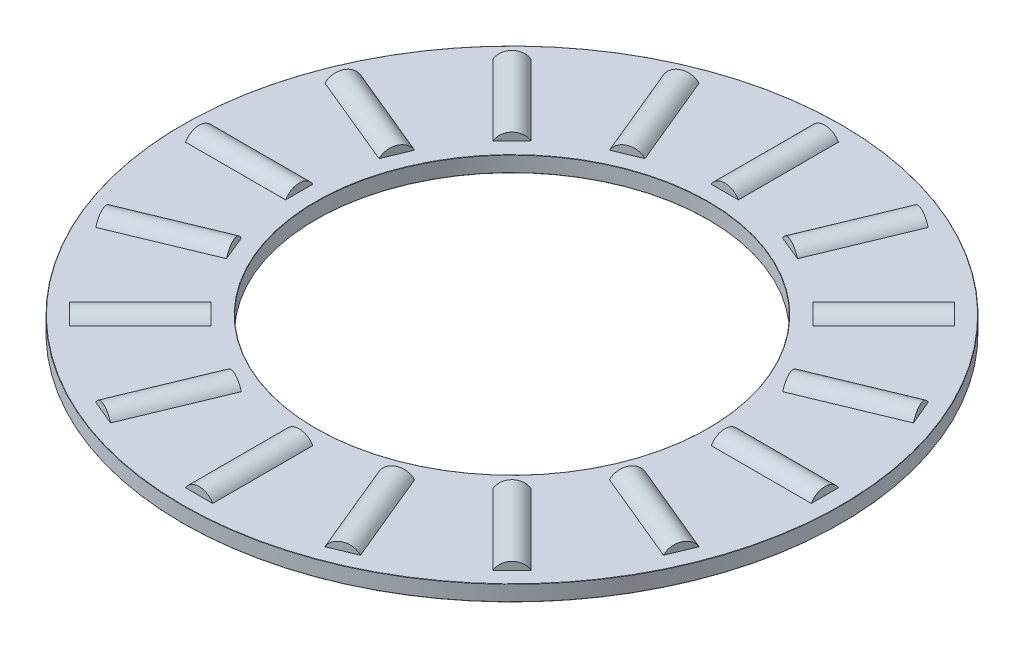
from build123d import *

# Parameters (mm, degrees)
SKETCH1_W         = 8.5
SKETCH1_H         = 1
SKETCH3_W         = 6.375
SKETCH3_H         = 1
SKETCH2_W         = 6.375
SKETCH2_H         = 1
CIRPATTERN1_COUNT = 16
CIRPATTERN1_ANGLE = 337.5
CIRPATTERN2_COUNT = 16
FILLET2_R         = 0.02


with BuildPart() as part:
    # Sketch1 → Revolve1 (revolve)
    with BuildSketch(Plane(origin=(0, 0, 0), x_dir=(0, 0, -1), z_dir=(1, 0, 0)), mode=Mode.PRIVATE) as revolve1_sk:
        with Locations((-16.75, 0)):
            Rectangle(SKETCH1_W, SKETCH1_H)
    revolve(revolve1_sk.sketch.rotate(Axis((0, -1, 0), (0, 1, 0)), 180), axis=Axis((0, -1, 0), (0, 1, 0)))

    # Sketch3 → Cut-Revolve1 (revolve, cut)
    with BuildSketch(Plane(origin=(0, 0, 0), x_dir=(0, 0, -1), z_dir=(1, 0, 0))):
        with Locations((-16.75, 0.5)):
            Rectangle(SKETCH3_W, SKETCH3_H)
    cut_revolve1 = revolve(axis=Axis((0, 0, 19.9375), (0, 0, -1)), mode=Mode.SUBTRACT)

    # CirPattern2: Cut-Revolve1 ×16 about axis
    cirpattern2_axis = Axis((0, 0, 0), (0, 1, 0))
    for i in range(1, CIRPATTERN2_COUNT):
        add(cut_revolve1.rotate(cirpattern2_axis, i * 360 / CIRPATTERN2_COUNT), mode=Mode.SUBTRACT)

    # Fillet2
    fillet2_edges = [part.edges().sort_by_distance(p)[0] for p in [
        (0, 0.5, 21),
        (0, 0.5, 12.5),
        (0, -0.5, 12.5),
        (0, -0.5, 21),
    ]]
    fillet(fillet2_edges, radius=FILLET2_R)


with BuildPart() as body_2:
    # Sketch2 → Revolve2 (revolve)
    with BuildSketch(Plane(origin=(0, 0, 0), x_dir=(0, 0, -1), z_dir=(1, 0, 0)), mode=Mode.PRIVATE) as revolve2_sk:
        with Locations((-16.75, 0.5)):
            Rectangle(SKETCH2_W, SKETCH2_H)
    revolve(revolve2_sk.sketch.rotate(Axis((0, 0, 19.9375), (0, 0, -1)), 90), axis=Axis((0, 0, 19.9375), (0, 0, -1)))


with BuildPart() as cirpattern1_1:
    # CirPattern1: pattern copy
    add(body_2.part.rotate(Axis((0, 1, 0), (0, -1, 0)), 1 * CIRPATTERN1_ANGLE / (CIRPATTERN1_COUNT - 1)))


with BuildPart() as cirpattern1_2:
    # CirPattern1: pattern copy
    add(body_2.part.rotate(Axis((0, 1, 0), (0, -1, 0)), 2 * CIRPATTERN1_ANGLE / (CIRPATTERN1_COUNT - 1)))


with BuildPart() as cirpattern1_3:
    # CirPattern1: pattern copy
    add(body_2.part.rotate(Axis((0, 1, 0), (0, -1, 0)), 3 * CIRPATTERN1_ANGLE / (CIRPATTERN1_COUNT - 1)))


with BuildPart() as cirpattern1_4:
    # CirPattern1: pattern copy
    add(body_2.part.rotate(Axis((0, 1, 0), (0, -1, 0)), 4 * CIRPATTERN1_ANGLE / (CIRPATTERN1_COUNT - 1)))


with BuildPart() as cirpattern1_5:
    # CirPattern1: pattern copy
    add(body_2.part.rotate(Axis((0, 1, 0), (0, -1, 0)), 5 * CIRPATTERN1_ANGLE / (CIRPATTERN1_COUNT - 1)))


with BuildPart() as cirpattern1_6:
    # CirPattern1: pattern copy
    add(body_2.part.rotate(Axis((0, 1, 0), (0, -1, 0)), 6 * CIRPATTERN1_ANGLE / (CIRPATTERN1_COUNT - 1)))


with BuildPart() as cirpattern1_7:
    # CirPattern1: pattern copy
    add(body_2.part.rotate(Axis((0, 1, 0), (0, -1, 0)), 7 * CIRPATTERN1_ANGLE / (CIRPATTERN1_COUNT - 1)))


with BuildPart() as cirpattern1_8:
    # CirPattern1: pattern copy
    add(body_2.part.rotate(Axis((0, 1, 0), (0, -1, 0)), 8 * CIRPATTERN1_ANGLE / (CIRPATTERN1_COUNT - 1)))


with BuildPart() as cirpattern1_9:
    # CirPattern1: pattern copy
    add(body_2.part.rotate(Axis((0, 1, 0), (0, -1, 0)), 9 * CIRPATTERN1_ANGLE / (CIRPATTERN1_COUNT - 1)))


with BuildPart() as cirpattern1_10:
    # CirPattern1: pattern copy
    add(body_2.part.rotate(Axis((0, 1, 0), (0, -1, 0)), 10 * CIRPATTERN1_ANGLE / (CIRPATTERN1_COUNT - 1)))


with BuildPart() as cirpattern1_11:
    # CirPattern1: pattern copy
    add(body_2.part.rotate(Axis((0, 1, 0), (0, -1, 0)), 11 * CIRPATTERN1_ANGLE / (CIRPATTERN1_COUNT - 1)))


with BuildPart() as cirpattern1_12:
    # CirPattern1: pattern copy
    add(body_2.part.rotate(Axis((0, 1, 0), (0, -1, 0)), 12 * CIRPATTERN1_ANGLE / (CIRPATTERN1_COUNT - 1)))


with BuildPart() as cirpattern1_13:
    # CirPattern1: pattern copy
    add(body_2.part.rotate(Axis((0, 1, 0), (0, -1, 0)), 13 * CIRPATTERN1_ANGLE / (CIRPATTERN1_COUNT - 1)))


with BuildPart() as cirpattern1_14:
    # CirPattern1: pattern copy
    add(body_2.part.rotate(Axis((0, 1, 0), (0, -1, 0)), 14 * CIRPATTERN1_ANGLE / (CIRPATTERN1_COUNT - 1)))


with BuildPart() as cirpattern1_15:
    # CirPattern1: pattern copy
    add(body_2.part.rotate(Axis((0, 1, 0), (0, -1, 0)), 15 * CIRPATTERN1_ANGLE / (CIRPATTERN1_COUNT - 1)))


solid = Compound([part.part, body_2.part, cirpattern1_1.part, cirpattern1_2.part, cirpattern1_3.part, cirpattern1_4.part, cirpattern1_5.part, cirpattern1_6.part, cirpattern1_7.part, cirpattern1_8.part, cirpattern1_9.part, cirpattern1_10.part, cirpattern1_11.part, cirpattern1_12.part, cirpattern1_13.part, cirpattern1_14.part, cirpattern1_15.part])
